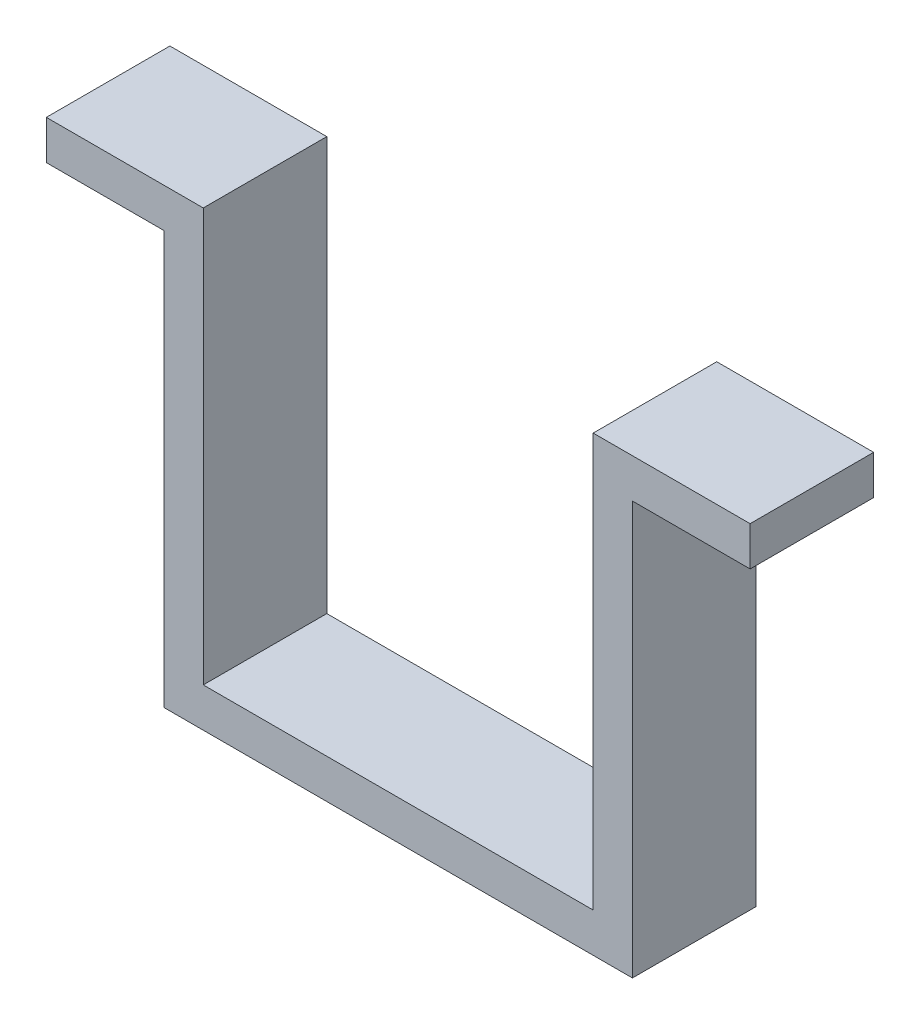
from build123d import *

# Parameters (mm, degrees)
BOSS_EXTRUDE1_DEPTH = 10


with BuildPart() as part:
    # Sketch1 → Boss-Extrude1 (new body)
    with BuildSketch(Plane.XY):
        Polygon((-18.955, 13.5415), (-18.955, -19.8915), (0, -19.8915), (18.955, -19.8915), (18.955, 13.5415), (28.48, 13.5415), (28.48, 16.7165), (15.78, 16.7165), (15.78, -16.7165), (0, -16.7165), (-15.78, -16.7165), (-15.78, 16.7165), (-28.48, 16.7165), (-28.48, 13.5415), align=None)
    extrude(amount=BOSS_EXTRUDE1_DEPTH)


solid = part.part
